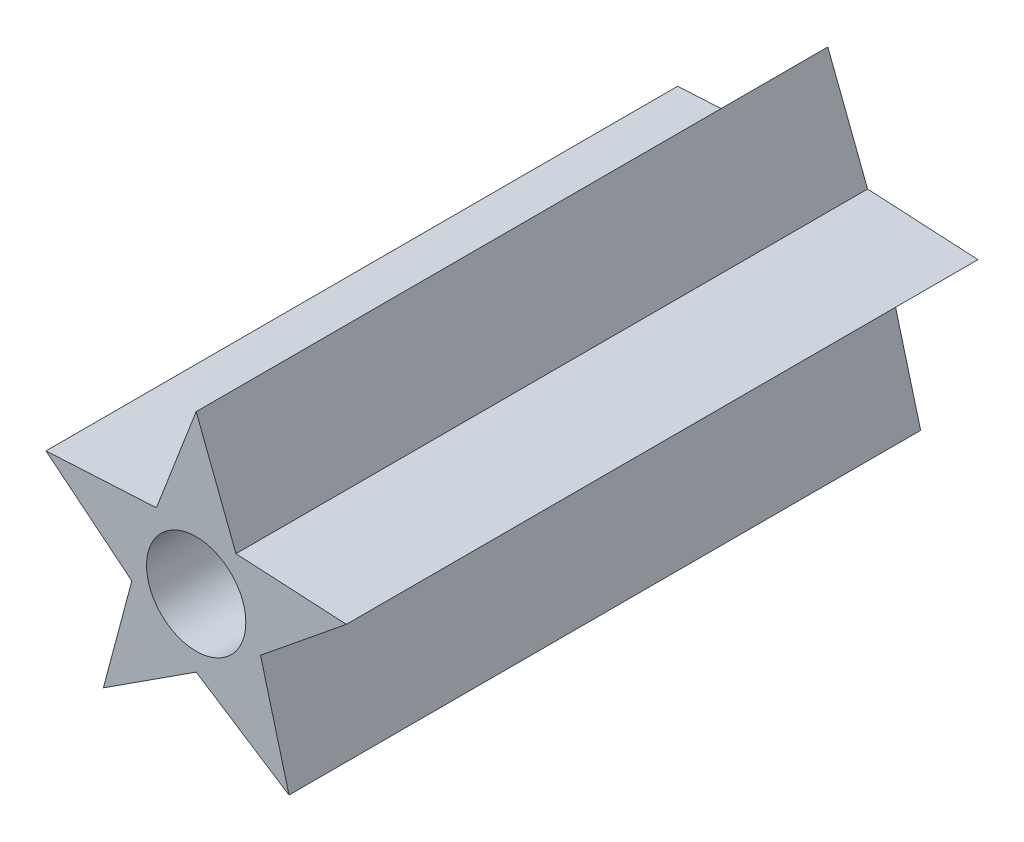
from build123d import *

# Parameters (mm, degrees)
BOSS_EXTRUDE1_DEPTH = 70
SKETCH2_R           = 5.5
CUT_EXTRUDE1_DEPTH  = 75.049008955


with BuildPart() as part:
    # Sketch1 → Boss-Extrude1 (new body)
    with BuildSketch(Plane.XY):
        Polygon((0, 17.5), (-4.408389392, 6.067627458), (-16.643489035, 5.407797402), (-7.132923872, -2.317627458), (-10.286241915, -14.157797402), (0, -7.5), (10.286241915, -14.157797402), (7.132923872, -2.317627458), (16.643489035, 5.407797402), (4.408389392, 6.067627458), align=None)
    extrude(amount=BOSS_EXTRUDE1_DEPTH)

    # Sketch2 → Cut-Extrude1 (cut, through all)
    with BuildSketch(Plane.XY.offset(70)):
        Circle(SKETCH2_R)
    extrude(amount=-CUT_EXTRUDE1_DEPTH, mode=Mode.SUBTRACT)


solid = part.part
